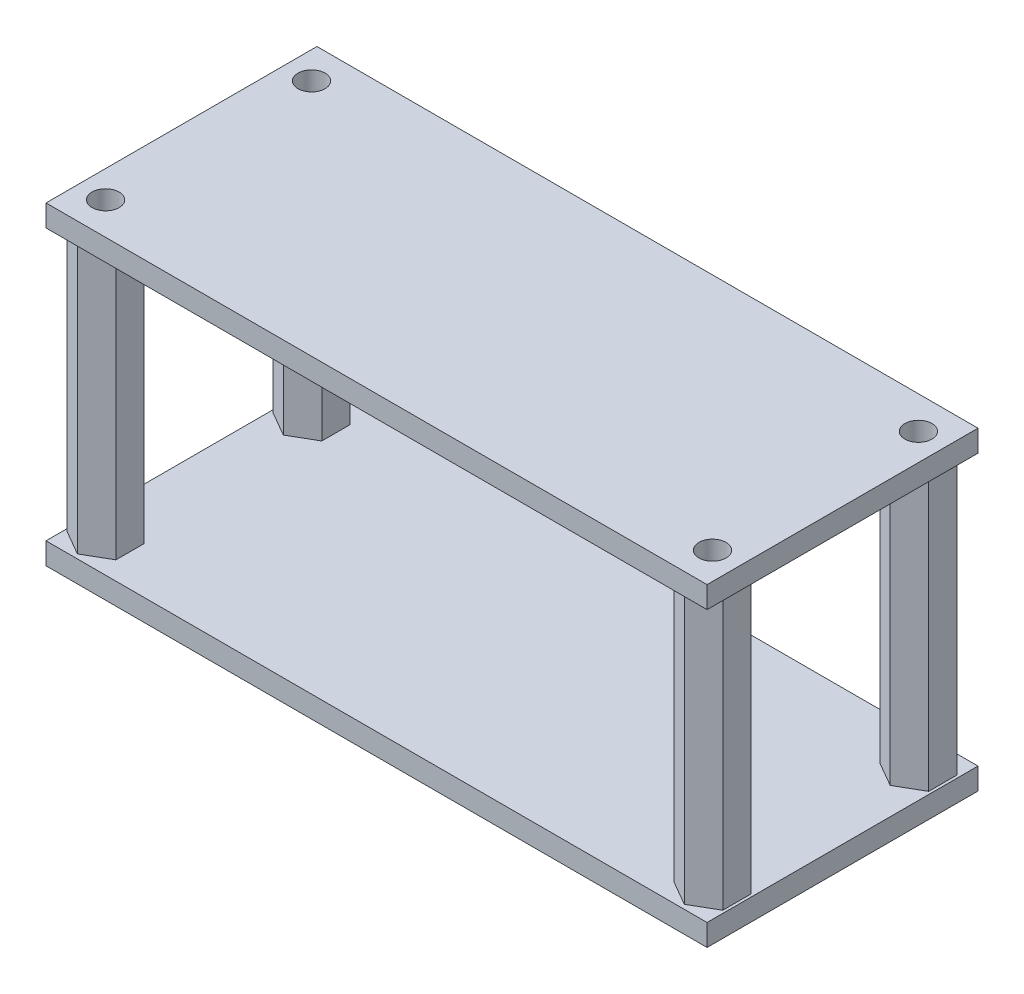
from build123d import *

# Parameters (mm, degrees)
SKETCH_1_W          = 61
SKETCH_1_H          = 25
EXTRUDE_1_DEPTH     = 2
SKETCH_2_R          = 1.25
CUT_EXTRUDE_1_DEPTH = 52
SKETCH_3_R          = 1.25
EXTRUDE_2_DEPTH     = 25
EXTRUDE_2_2_DEPTH   = 25
EXTRUDE_2_3_DEPTH   = 25
EXTRUDE_2_4_DEPTH   = 25


with BuildPart() as part:
    # 草图1 → 凸台-拉伸1 (new body)
    with BuildSketch(Plane(origin=(0, 0, 0), x_dir=(1, 0, 0), z_dir=(0, 1, 0))):
        Rectangle(SKETCH_1_W, SKETCH_1_H)
    extrude(amount=EXTRUDE_1_DEPTH)

    # 草图2 → 切除-拉伸1 (cut)
    with BuildSketch(Plane(origin=(0, 2, 0), x_dir=(1, 0, 0), z_dir=(0, 1, 0))):
        with Locations(Location((-28, 9.5, 0), (0, 0, 270))):
            Circle(SKETCH_2_R)
        with Locations(Location((-28, -9.5, 0), (0, 0, 270))):
            Circle(SKETCH_2_R)
        with Locations(Location((28, 9.5, 0), (0, 0, 270))):
            Circle(SKETCH_2_R)
        with Locations(Location((28, -9.5, 0), (0, 0, 270))):
            Circle(SKETCH_2_R)
    extrude(amount=-CUT_EXTRUDE_1_DEPTH, mode=Mode.SUBTRACT)


with BuildPart() as body_2:
    # 草图3 → 凸台-拉伸2 (new body)
    with BuildSketch(Plane(origin=(0, 2, 0), x_dir=(1, 0, 0), z_dir=(0, 1, 0))):
        Polygon((-25.75, 10.799038106), (-28, 12.098076211), (-30.25, 10.799038106), (-30.25, 8.200961894), (-28, 6.901923789), (-25.75, 8.200961894), align=None)
        with Locations(Location((-28, 9.5, 0), (0, 0, 270))):
            Circle(SKETCH_3_R, mode=Mode.SUBTRACT)
    extrude(amount=EXTRUDE_2_DEPTH)


with BuildPart() as body_3:
    # 草图3 → Extrude 2 2 (new body)
    with BuildSketch(Plane(origin=(0, 2, 0), x_dir=(1, 0, 0), z_dir=(0, 1, 0))):
        Polygon((25.75, 8.200961894), (25.75, 10.799038106), (28, 12.098076211), (30.25, 10.799038106), (30.25, 8.200961894), (28, 6.901923789), align=None)
        with Locations(Location((28, 9.5, 0), (0, 0, 90))):
            Circle(SKETCH_3_R, mode=Mode.SUBTRACT)
    extrude(amount=EXTRUDE_2_2_DEPTH)


with BuildPart() as body_4:
    # 草图3 → Extrude 2 3 (new body)
    with BuildSketch(Plane(origin=(0, 2, 0), x_dir=(1, 0, 0), z_dir=(0, 1, 0))):
        Polygon((25.75, -10.799038106), (28, -12.098076211), (30.25, -10.799038106), (30.25, -8.200961894), (28, -6.901923789), (25.75, -8.200961894), align=None)
        with Locations(Location((28, -9.5, 0), (0, 0, 270))):
            Circle(SKETCH_3_R, mode=Mode.SUBTRACT)
    extrude(amount=EXTRUDE_2_3_DEPTH)


with BuildPart() as body_5:
    # 草图3 → Extrude 2 4 (new body)
    with BuildSketch(Plane(origin=(0, 2, 0), x_dir=(1, 0, 0), z_dir=(0, 1, 0))):
        Polygon((-25.75, -8.200961894), (-25.75, -10.799038106), (-28, -12.098076211), (-30.25, -10.799038106), (-30.25, -8.200961894), (-28, -6.901923789), align=None)
        with Locations(Location((-28, -9.5, 0), (0, 0, 90))):
            Circle(SKETCH_3_R, mode=Mode.SUBTRACT)
    extrude(amount=EXTRUDE_2_4_DEPTH)


with BuildPart() as body_6:
    # Move Body 1: copy of part
    add(part.part.moved(Location((0, 27, 0))))


solid = Compound([part.part, body_2.part, body_3.part, body_4.part, body_5.part, body_6.part])
